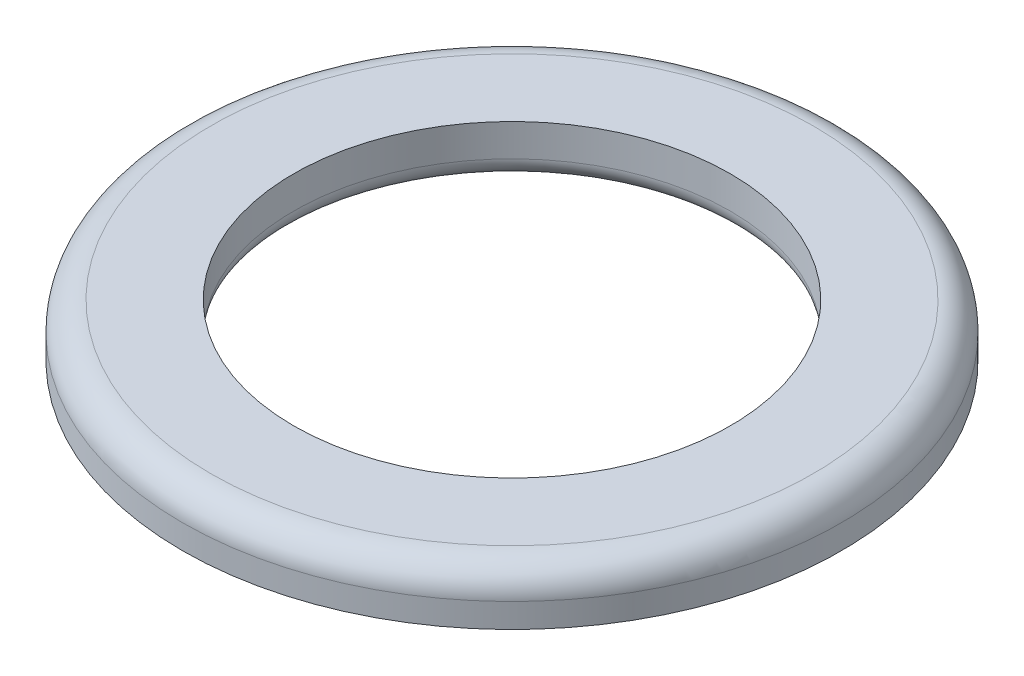
from build123d import *

# Parameters (mm, degrees)
SKETCH1_R           = 8.15
SKETCH1_R_2         = 5.4
BOSS_EXTRUDE1_DEPTH = 1.3
FILLET3_R           = 0.7
FILLET4_R           = 0.5


with BuildPart() as part:
    # Sketch1 → Boss-Extrude1 (new body)
    with BuildSketch(Plane(origin=(0, 0, 0), x_dir=(1, 0, 0), z_dir=(0, 1, 0))):
        with Locations(Location((0, 0, 0), (0, 0, 270))):
            Circle(SKETCH1_R)
        with Locations(Location((0, 0, 0), (0, 0, 270))):
            Circle(SKETCH1_R_2, mode=Mode.SUBTRACT)
    extrude(amount=BOSS_EXTRUDE1_DEPTH)

    # Fillet3
    fillet3_edges = [part.edges().sort_by_distance(p)[0] for p in [
        (0, 1.3, -8.15),
    ]]
    fillet(fillet3_edges, radius=FILLET3_R)

    # Fillet4
    fillet4_edges = [part.edges().sort_by_distance(p)[0] for p in [
        (0, 0, -5.4),
    ]]
    fillet(fillet4_edges, radius=FILLET4_R)


solid = part.part
